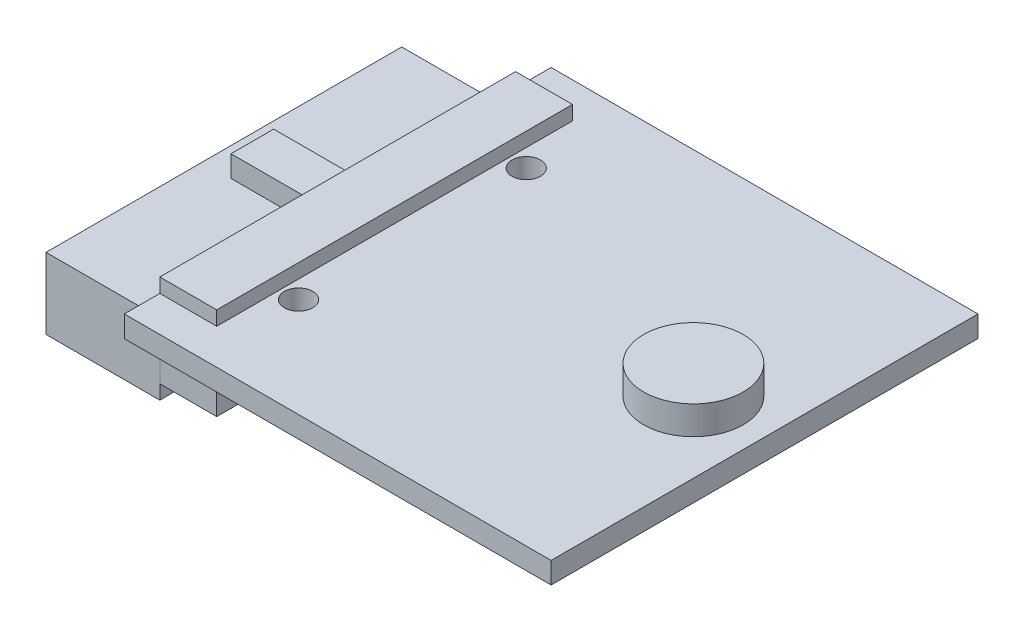
from build123d import *

# Parameters (mm, degrees)
SKETCH_1_R           = 1
EXTRUDE_1_DEPTH      = 1.5
SKETCH_1_3_W         = 8
SKETCH_1_3_H         = 25
EXTRUDE_2_DEPTH      = 5
EXTRUDE_3_DEPTH      = 2.5
EXTRUDE_3_DEPTH_BACK = 4
SKETCH_1_5_R         = 3.5
EXTRUDE_4_DEPTH      = 3.5


with BuildPart() as part:
    # Эскиз1 → Бобышка-Вытянуть1 (new body)
    with BuildSketch(Plane(origin=(0, 0, 0), x_dir=(1, 0, 0), z_dir=(0, 1, 0))):
        Polygon((-21, -1.5), (-15, -1.5), (-15, -15), (15, -15), (15, 15), (-15, 15), (-15, 1.5), (-21, 1.5), align=None)
        with Locations((-9.75, -8)):
            Circle(SKETCH_1_R, mode=Mode.SUBTRACT)
        with Locations((-9.75, 8)):
            Circle(SKETCH_1_R, mode=Mode.SUBTRACT)
    extrude(amount=EXTRUDE_1_DEPTH)

    # Эскиз1<5> → Бобышка-Вытянуть4 (add)
    with BuildSketch(Plane(origin=(0, 0, 0), x_dir=(1, 0, 0), z_dir=(0, 1, 0))):
        with Locations((10, 0)):
            Circle(SKETCH_1_5_R)
    extrude(amount=EXTRUDE_4_DEPTH)


with BuildPart() as body_2:
    # Эскиз1<3> → Бобышка-Вытянуть2 (new body)
    with BuildSketch(Plane(origin=(0, 0, 0), x_dir=(1, 0, 0), z_dir=(0, 1, 0))):
        with Locations((-19, 0)):
            Rectangle(SKETCH_1_3_W, SKETCH_1_3_H)
    extrude(amount=-EXTRUDE_2_DEPTH)


with BuildPart() as body_3:
    # Эскиз1<4> → Бобышка-Вытянуть3 (new, two sides: drawn at the far end of the back side and taken through both)
    with BuildSketch(Plane(origin=(0, 0, 0), x_dir=(1, 0, 0), z_dir=(0, 1, 0)).offset(-EXTRUDE_3_DEPTH_BACK)):
        Polygon((-15, 1.5), (-15, -1.5), (-15, -12.5), (-11, -12.5), (-11, 12.5), (-15, 12.5), align=None)
    extrude(amount=EXTRUDE_3_DEPTH + EXTRUDE_3_DEPTH_BACK)


solid = Compound([part.part, body_2.part, body_3.part])
